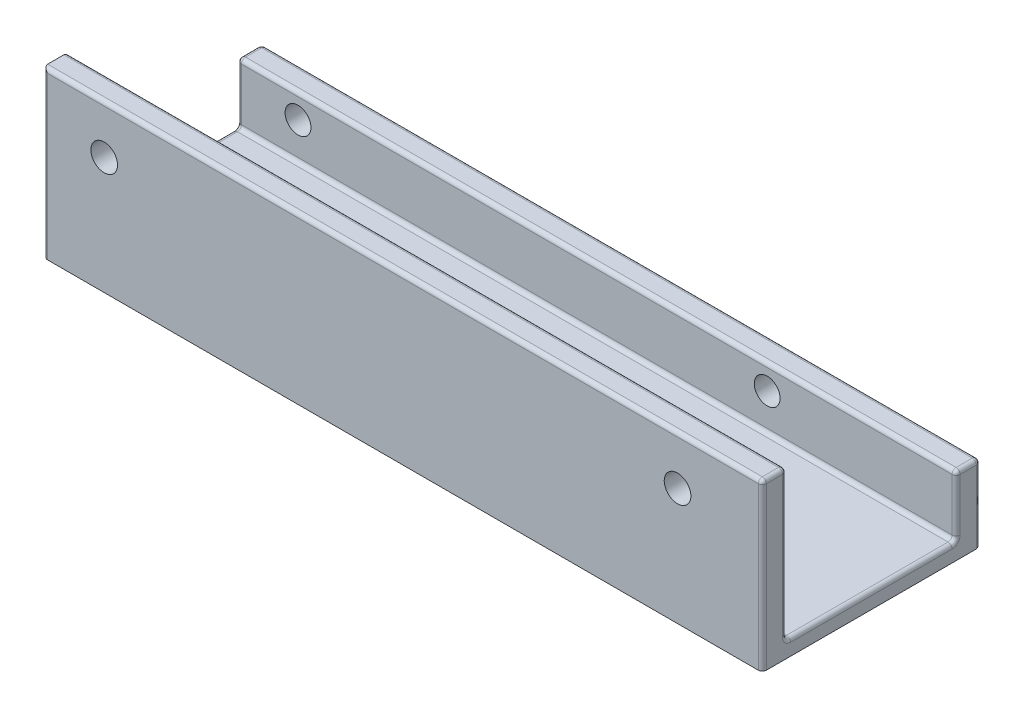
from build123d import *

# Parameters (mm, degrees)
SKETCH1_W           = 85
SKETCH1_H           = 24
BOSS_EXTRUDE1_DEPTH = 3
SKETCH2_W           = 85
SKETCH2_H           = 17.5
BOSS_EXTRUDE2_DEPTH = 3
SKETCH3_W           = 85
SKETCH3_H           = 3
BOSS_EXTRUDE3_DEPTH = 3.5
SKETCH4_R           = 1.65
CUT_EXTRUDE1_DEPTH  = 3
SKETCH5_R           = 1.6
CUT_EXTRUDE2_DEPTH  = 3
SKETCH6_W           = 85
SKETCH6_H           = 27
BOSS_EXTRUDE4_DEPTH = 3
SKETCH7_W           = 85
SKETCH7_H           = 21
CUT_EXTRUDE3_DEPTH  = 4
BOSS_EXTRUDE5_DEPTH = 4
FILLET4_R           = 0.5
SKETCH9_W           = 7
SKETCH9_H           = 10
BOSS_EXTRUDE6_DEPTH = 8
CHAMFER1_SIZE       = 0.7
CHAMFER2_SIZE       = 0.5


with BuildPart() as part:
    # Sketch1 → Boss-Extrude1 (new body)
    with BuildSketch(Plane(origin=(0, 0, 0), x_dir=(1, 0, 0), z_dir=(0, 1, 0))):
        Rectangle(SKETCH1_W, SKETCH1_H)
    extrude(amount=BOSS_EXTRUDE1_DEPTH)

    # Sketch2 → Boss-Extrude2 (add)
    with BuildSketch(Plane.XY.offset(12)):
        with Locations((0, 8.75)):
            Rectangle(SKETCH2_W, SKETCH2_H)
    extrude(amount=BOSS_EXTRUDE2_DEPTH)

    # Sketch3 → Boss-Extrude3 (add)
    with BuildSketch(Plane(origin=(0, 3, 0), x_dir=(1, 0, 0), z_dir=(0, 1, 0))):
        with Locations((0, 10.5)):
            Rectangle(SKETCH3_W, SKETCH3_H)
    extrude(amount=BOSS_EXTRUDE3_DEPTH)

    # Sketch4 → Cut-Extrude1 (cut)
    with BuildSketch(Plane.XY.offset(15)):
        with Locations((-39, 11.5)):
            Circle(SKETCH4_R)
        with Locations((32, 11.5)):
            Circle(SKETCH4_R)
    extrude(amount=-CUT_EXTRUDE1_DEPTH, mode=Mode.SUBTRACT)

    # Sketch5 → Cut-Extrude2 (cut)
    with BuildSketch(Plane(origin=(0, 0, -12), x_dir=(-1, 0, 0), z_dir=(0, 0, -1))):
        with Locations((39, 3.5)):
            Circle(SKETCH5_R)
        with Locations((-19.1, 3.5)):
            Circle(SKETCH5_R)
    extrude(amount=-CUT_EXTRUDE2_DEPTH, mode=Mode.SUBTRACT)

    # Sketch6 → Boss-Extrude4 (add)
    with BuildSketch(Plane.XZ):
        with Locations((0, 1.5)):
            Rectangle(SKETCH6_W, SKETCH6_H)
    extrude(amount=BOSS_EXTRUDE4_DEPTH)

    # Sketch7 → Cut-Extrude3 (cut)
    with BuildSketch(Plane(origin=(0, 3, 0), x_dir=(1, 0, 0), z_dir=(0, 1, 0))):
        with Locations((0, -1.5)):
            Rectangle(SKETCH7_W, SKETCH7_H)
    extrude(amount=-CUT_EXTRUDE3_DEPTH, mode=Mode.SUBTRACT)

    # Sketch8 → Boss-Extrude5 (add)
    with BuildSketch(Plane.ZY.offset(42.5)):
        Polygon((-12, 6.5), (-9, 6.5), (-9, -1), (12, -1), (12, 17.5), (15, 17.5), (15, -3), (-12, -3), align=None)
    extrude(amount=BOSS_EXTRUDE5_DEPTH)

    # Fillet4
    fillet4_edges = [part.edges().sort_by_distance(p)[0] for p in [
        (42.5, 8.25, 12),
        (-2, 17.5, 12),
        (42.5, 17.5, 13.5),
        (42.5, 7.25, 15),
        (-2, 17.5, 15),
        (42.5, 2.75, -9),
        (-2, 6.5, -9),
        (42.5, 6.5, -10.5),
        (-2, 6.5, -12),
        (-37.4, 3.5, -12),
        (20.7, 3.5, -12),
        (-2, -3, -12),
        (-2, -1, -9),
        (42.5, -1, 1.5),
        (-2, -1, 12),
        (42.5, 1.75, -12),
        (-46.5, 1.75, -12),
        (-46.5, 7.25, 15),
        (-46.5, 8.25, 12),
        (-46.5, -1, 1.5),
        (-46.5, 2.75, -9),
        (-46.5, 6.5, -10.5),
    ]]
    fillet(fillet4_edges, radius=FILLET4_R)

    # Sketch9 → Boss-Extrude6 (add)
    with BuildSketch(Plane.XZ.offset(3)):
        with Locations((0, 1.5)):
            Rectangle(SKETCH9_W, SKETCH9_H)
    extrude(amount=BOSS_EXTRUDE6_DEPTH)

    # Chamfer1
    chamfer1_edges = [part.edges().sort_by_distance(p)[0] for p in [
        (3.5, -11, 1.5),
        (0, -11, 6.5),
        (-3.5, -11, 1.5),
        (0, -11, -3.5),
    ]]
    chamfer(chamfer1_edges, length=CHAMFER1_SIZE)

    # Chamfer2
    chamfer2_edges = [part.edges().sort_by_distance(p)[0] for p in [
        (3.5, -6.65, -3.5),
        (-3.5, -6.65, -3.5),
        (-3.5, -6.65, 6.5),
        (3.5, -6.65, 6.5),
    ]]
    chamfer(chamfer2_edges, length=CHAMFER2_SIZE)


solid = part.part
